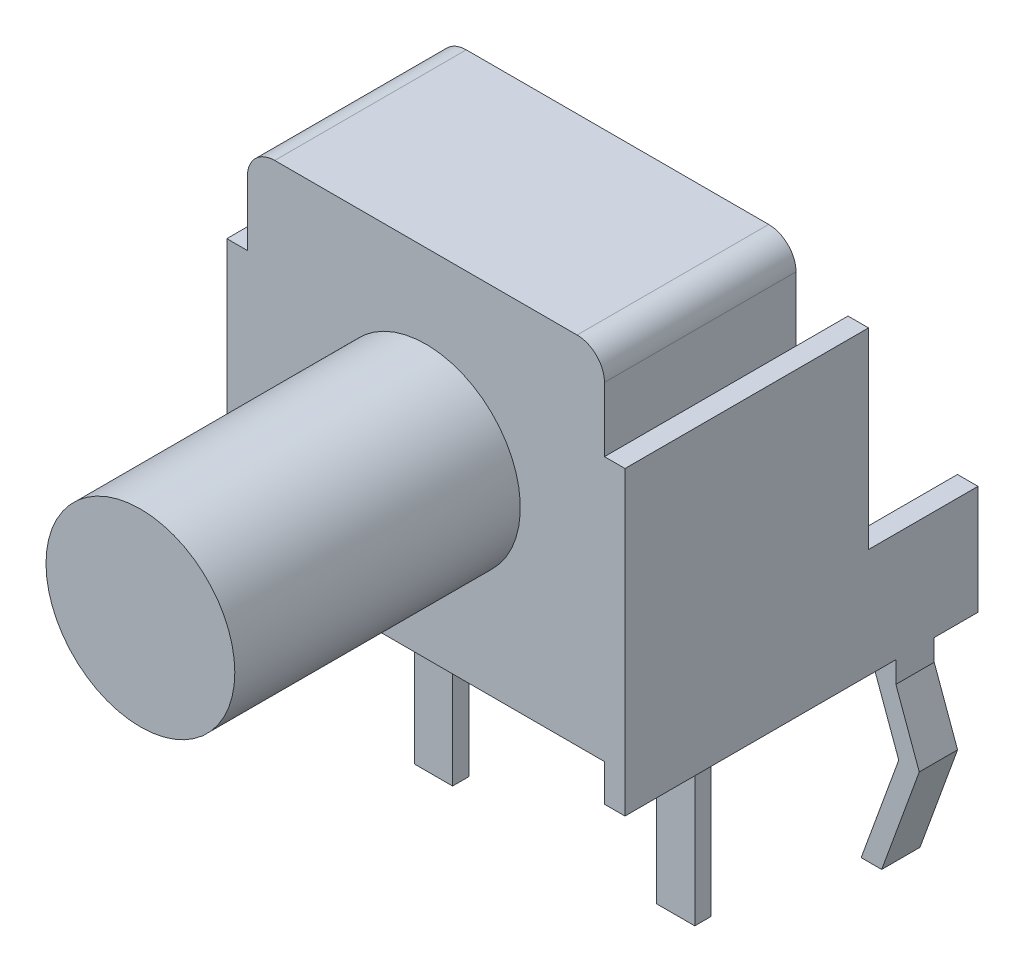
from build123d import *

# Parameters (mm, degrees)
EXTRUDE2_DEPTH      = 6.35
SKETCH3_OUTSIDE_W   = 18.322
SKETCH3_OUTSIDE_H   = 16.747
CUT_EXTRUDE1_DEPTH  = 7.62
SKETCH4_W           = 6.6294
SKETCH4_H           = 5.959117839
CUT_EXTRUDE2_DEPTH  = 12.7
EXTRUDE3_DEPTH      = 2.54
EXTRUDE3_DEPTH_BACK = 3.5052
SKETCH5_W           = 0.7112
SKETCH5_H           = 0.3048
SKETCH6_R           = 1.7526
EXTRUDE4_DEPTH      = 5.3


with BuildPart() as part:
    # Sketch2 → Extrude2 (new, symmetric)
    with BuildSketch(Plane(origin=(0, 0, 0), x_dir=(0, 0, -1), z_dir=(1, 0, 0))):
        Polygon((0, 0), (5.0292, 0), (5.0292, -3.5052), (5.7404, -3.5052), (5.7404, 0), (6.5532, 0), (6.5532, 2.025013386), (4.5212, 2.025013386), (4.5212, 5.588), (3.556, 5.588), (3.556, 7.62), (0, 7.62), align=None)
    extrude(amount=EXTRUDE2_DEPTH, both=True)

    # Sketch3 outside → Cut-Extrude1 (cut, symmetric)
    with BuildSketch(Plane.XY):
        with Locations((0, 2.0575)):
            Rectangle(SKETCH3_OUTSIDE_W, SKETCH3_OUTSIDE_H)
        with BuildLine():
            Line((-3.3147, 0.6858), (3.3147, 0.6858))
            Line((3.3147, 0.6858), (3.3147, -0.396973009))
            Line((3.3147, -0.396973009), (3.748326519, -1.588352079))
            Line((3.748326519, -1.588352079), (2.978268534, -3.704069007))
            Line((2.978268534, -3.704069007), (3.3147, -3.826520046))
            Line((3.3147, -3.826520046), (4.129326519, -1.588352079))
            Line((4.129326519, -1.588352079), (3.6957, -0.396973009))
            Line((3.6957, -0.396973009), (3.6957, 5.588))
            Line((3.6957, 5.588), (3.3147, 5.588))
            Line((3.3147, 5.588), (3.3147, 6.7818))
            ThreePointArc((3.3147, 6.7818), (3.165910245, 7.141010245), (2.8067, 7.2898))
            Line((2.8067, 7.2898), (-2.8067, 7.2898))
            ThreePointArc((-2.8067, 7.2898), (-3.165910245, 7.141010245), (-3.3147, 6.7818))
            Line((-3.3147, 6.7818), (-3.3147, 5.588))
            Line((-3.3147, 5.588), (-3.6957, 5.588))
            Line((-3.6957, 5.588), (-3.6957, -0.396973009))
            Line((-3.6957, -0.396973009), (-4.129326519, -1.588352079))
            Line((-4.129326519, -1.588352079), (-3.3147, -3.826520046))
            Line((-3.3147, -3.826520046), (-2.978268534, -3.704069007))
            Line((-2.978268534, -3.704069007), (-3.748326519, -1.588352079))
            Line((-3.748326519, -1.588352079), (-3.3147, -0.396973009))
            Line((-3.3147, -0.396973009), (-3.3147, 0.6858))
        make_face(mode=Mode.SUBTRACT)
    extrude(amount=CUT_EXTRUDE1_DEPTH, both=True, mode=Mode.SUBTRACT)

    # Sketch4 → Cut-Extrude2 (cut)
    with BuildSketch(Plane(origin=(0, 0, 0), x_dir=(1, 0, 0), z_dir=(0, 1, 0))):
        with Locations((0, 6.535558919)):
            Rectangle(SKETCH4_W, SKETCH4_H)
    extrude(amount=CUT_EXTRUDE2_DEPTH, mode=Mode.SUBTRACT)

    # Sketch5 → Extrude3 (add, two sides: drawn at the far end of the back side and taken through both)
    with BuildSketch(Plane(origin=(0, 0, 0), x_dir=(1, 0, 0), z_dir=(0, 1, 0)).offset(-EXTRUDE3_DEPTH_BACK)):
        with Locations((2.2479, 2.54)):
            Rectangle(SKETCH5_W, SKETCH5_H)
        with Locations((-2.2479, 2.54)):
            Rectangle(SKETCH5_W, SKETCH5_H)
    extrude(amount=EXTRUDE3_DEPTH + EXTRUDE3_DEPTH_BACK)

    # Sketch6 → Extrude4 (add)
    with BuildSketch(Plane.XY):
        with Locations(Location((0, 3.9878, 0), (0, 0, 180))):
            Circle(SKETCH6_R)
    extrude(amount=EXTRUDE4_DEPTH)


solid = part.part
